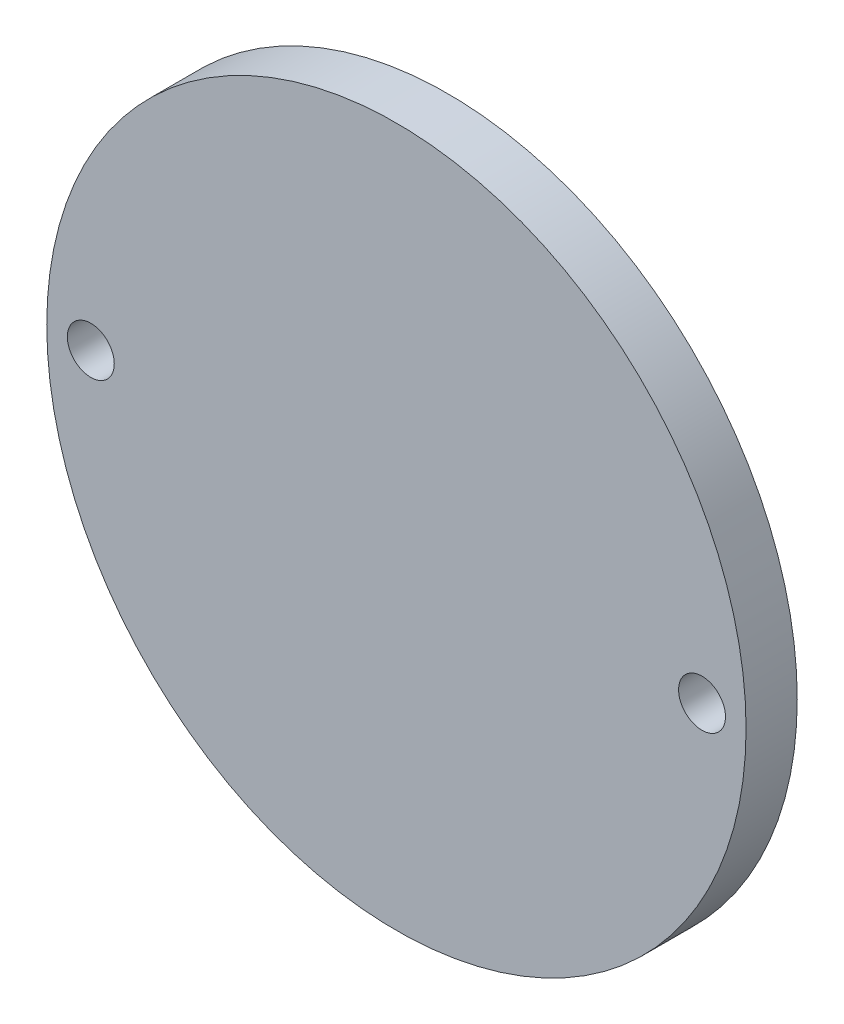
from build123d import *

# Parameters (mm, degrees)
SKETCH1_R           = 24.6
BOSS_EXTRUDE1_DEPTH = 3.6
SKETCH2_R           = 1.65
CUT_EXTRUDE1_DEPTH  = 35.97541994


with BuildPart() as part:
    # Sketch1 → Boss-Extrude1 (new body)
    with BuildSketch(Plane.XY):
        Circle(SKETCH1_R)
    extrude(amount=BOSS_EXTRUDE1_DEPTH)

    # Sketch2 → Cut-Extrude1 (cut, through all)
    with BuildSketch(Plane.XY.offset(3.6)):
        with Locations((-21.5, 0)):
            Circle(SKETCH2_R)
        with Locations((21.5, 0)):
            Circle(SKETCH2_R)
    extrude(amount=-CUT_EXTRUDE1_DEPTH, mode=Mode.SUBTRACT)


solid = part.part
